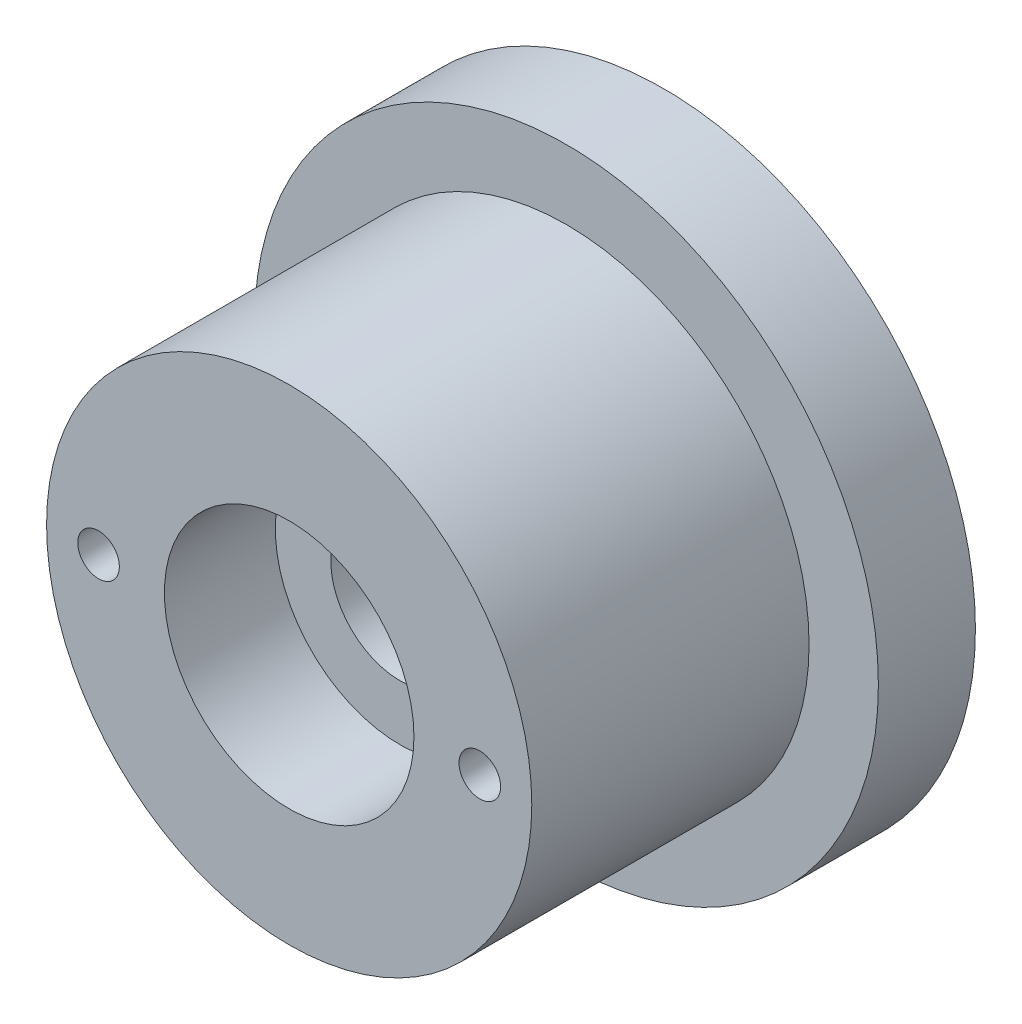
from build123d import *

# Parameters (mm, degrees)
SKETCH1_R           = 17.5
SKETCH1_R_2         = 5
SKETCH1_R_3         = 1.5
BOSS_EXTRUDE1_DEPTH = 13.5
BOSS_EXTRUDE2_START = -7
SKETCH2_R           = 22.5
SKETCH2_R_2         = 17.5
BOSS_EXTRUDE2_DEPTH = 7
SKETCH3_R           = 7.5
SKETCH3_R_2         = 5
BOSS_EXTRUDE3_DEPTH = 8.5
SKETCH4_R           = 9
CUT_EXTRUDE1_DEPTH  = 8


with BuildPart() as part:
    # Sketch1 → Boss-Extrude1 (new, symmetric)
    with BuildSketch(Plane.XY):
        Circle(SKETCH1_R)
        Circle(SKETCH1_R_2, mode=Mode.SUBTRACT)
        with Locations((-13.75, 0)):
            Circle(SKETCH1_R_3, mode=Mode.SUBTRACT)
        with Locations((13.75, 0)):
            Circle(SKETCH1_R_3, mode=Mode.SUBTRACT)
    extrude(amount=BOSS_EXTRUDE1_DEPTH, both=True)

    # Sketch2 → Boss-Extrude2 (add)
    with BuildSketch(Plane(origin=(0, 0, -13.5), x_dir=(-1, 0, 0), z_dir=(0, 0, -1)).offset(BOSS_EXTRUDE2_START)):
        Circle(SKETCH2_R)
        Circle(SKETCH2_R_2, mode=Mode.SUBTRACT)
    extrude(amount=BOSS_EXTRUDE2_DEPTH)

    # Sketch3 → Boss-Extrude3 (add, symmetric)
    with BuildSketch(Plane.XY):
        Circle(SKETCH3_R)
        Circle(SKETCH3_R_2, mode=Mode.SUBTRACT)
    extrude(amount=BOSS_EXTRUDE3_DEPTH, both=True)

    # Sketch4 → Cut-Extrude1 (cut)
    with BuildSketch(Plane.XY.offset(13.5)):
        Circle(SKETCH4_R)
    extrude(amount=-CUT_EXTRUDE1_DEPTH, mode=Mode.SUBTRACT)


solid = part.part
